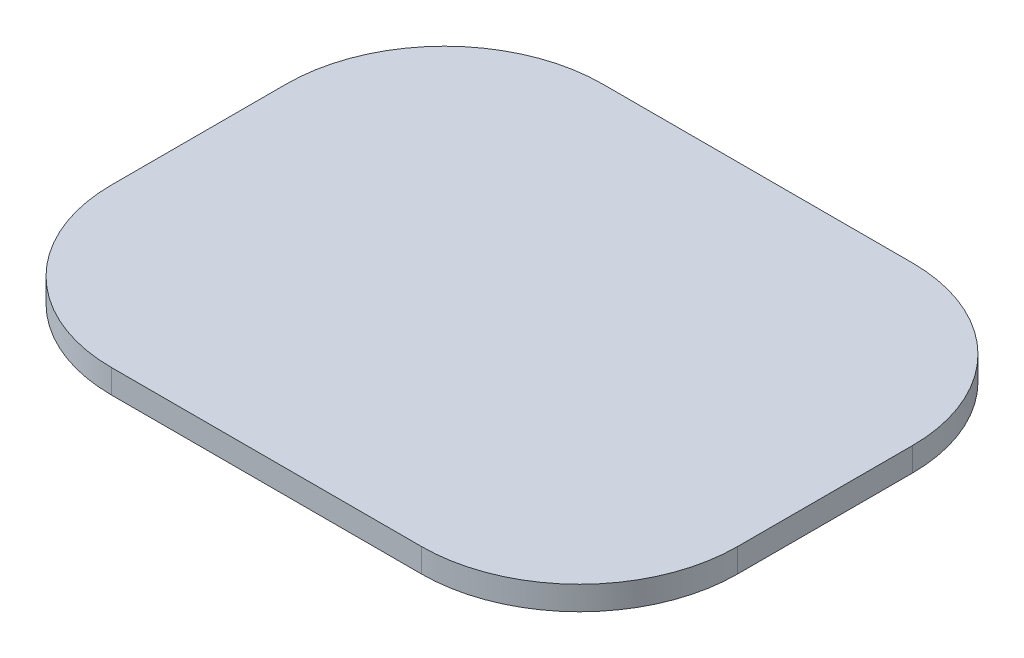
from build123d import *

# Parameters (mm, degrees)
BOSS_EXTRUDE1_DEPTH = 1.5


with BuildPart() as part:
    # Sketch1 → Boss-Extrude1 (new, symmetric)
    with BuildSketch(Plane(origin=(0, 0, 0), x_dir=(1, 0, 0), z_dir=(0, 1, 0))):
        with BuildLine():
            Line((-19.5, 30.9), (19.5, 30.9))
            ThreePointArc((19.5, 30.9), (33.571424946, 25.071424946), (39.4, 11))
            Line((39.4, 11), (39.4, -11))
            ThreePointArc((39.4, -11), (33.571424946, -25.071424946), (19.5, -30.9))
            Line((19.5, -30.9), (-19.5, -30.9))
            ThreePointArc((-19.5, -30.9), (-33.571424946, -25.071424946), (-39.4, -11))
            Line((-39.4, -11), (-39.4, 11))
            ThreePointArc((-39.4, 11), (-33.571424946, 25.071424946), (-19.5, 30.9))
        make_face()
    extrude(amount=BOSS_EXTRUDE1_DEPTH, both=True)


solid = part.part
